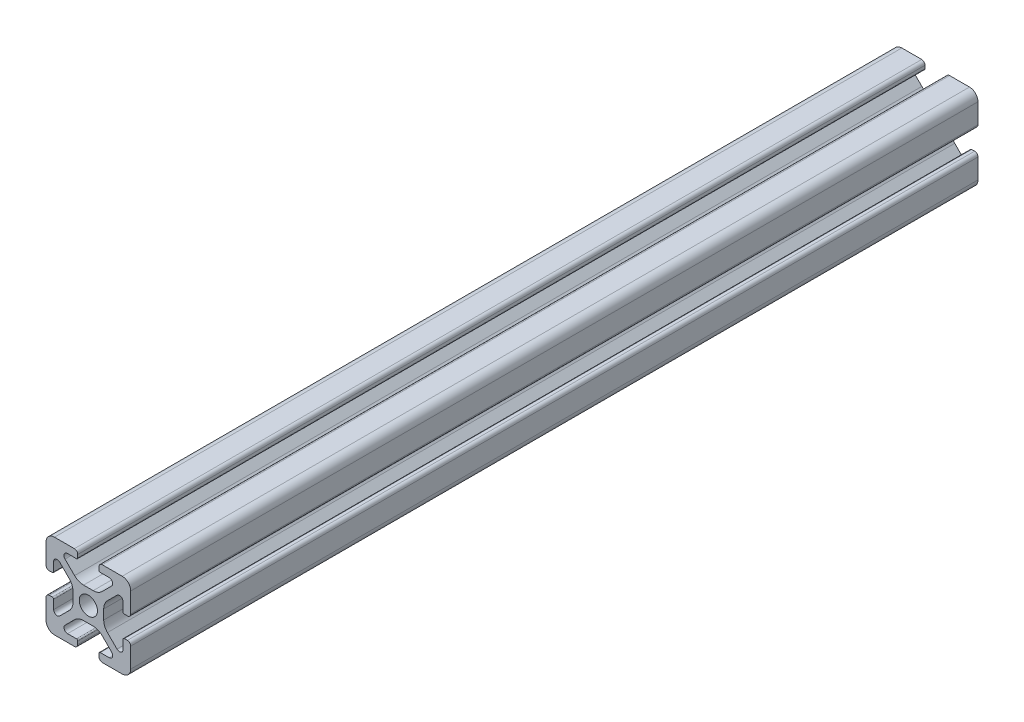
from build123d import *

# Parameters (mm, degrees)
SKETCH1_R           = 2.1463
BOSS_EXTRUDE1_DEPTH = 100


with BuildPart() as part:
    # Sketch1 → Boss-Extrude1 (new, symmetric)
    with BuildSketch(Plane.XY):
        with BuildLine():
            Line((-9.9949, 7.9883), (-9.9949, 3.2893))
            ThreePointArc((-9.9949, 3.2893), (-9.76427588, 2.73252412), (-9.2075, 2.5019))
            Line((-9.2075, 2.5019), (-8.4963, 2.5019))
            ThreePointArc((-8.4963, 2.5019), (-8.280773853, 2.591173853), (-8.1915, 2.8067))
            Line((-8.1915, 2.8067), (-8.1915, 4.9149))
            ThreePointArc((-8.1915, 4.9149), (-7.674065253, 5.689295824), (-6.760603096, 5.507596904))
            Line((-6.760603096, 5.507596904), (-4.505765747, 3.252759555))
            ThreePointArc((-4.505765747, 3.252759555), (-3.856054457, 2.280397894), (-3.627906192, 1.133419111))
            Line((-3.627906192, 1.133419111), (-3.627906192, -1.133419111))
            ThreePointArc((-3.627906192, -1.133419111), (-3.856054457, -2.280397894), (-4.505765747, -3.252759555))
            Line((-4.505765747, -3.252759555), (-6.760603096, -5.507596904))
            ThreePointArc((-6.760603096, -5.507596904), (-7.674065253, -5.689295824), (-8.1915, -4.9149))
            Line((-8.1915, -4.9149), (-8.1915, -2.8067))
            ThreePointArc((-8.1915, -2.8067), (-8.280773853, -2.591173853), (-8.4963, -2.5019))
            Line((-8.4963, -2.5019), (-9.2075, -2.5019))
            ThreePointArc((-9.2075, -2.5019), (-9.76427588, -2.73252412), (-9.9949, -3.2893))
            Line((-9.9949, -3.2893), (-9.9949, -7.9883))
            ThreePointArc((-9.9949, -7.9883), (-9.407180467, -9.407180467), (-7.9883, -9.9949))
            Line((-7.9883, -9.9949), (-3.2893, -9.9949))
            ThreePointArc((-3.2893, -9.9949), (-2.73252412, -9.76427588), (-2.5019, -9.2075))
            Line((-2.5019, -9.2075), (-2.5019, -8.4963))
            ThreePointArc((-2.5019, -8.4963), (-2.591173853, -8.280773853), (-2.8067, -8.1915))
            Line((-2.8067, -8.1915), (-4.9149, -8.1915))
            ThreePointArc((-4.9149, -8.1915), (-5.689295824, -7.674065253), (-5.507596904, -6.760603096))
            Line((-5.507596904, -6.760603096), (-3.252759555, -4.505765747))
            ThreePointArc((-3.252759555, -4.505765747), (-2.280397894, -3.856054457), (-1.133419111, -3.627906192))
            Line((-1.133419111, -3.627906192), (1.133419111, -3.627906192))
            ThreePointArc((1.133419111, -3.627906192), (2.280397894, -3.856054457), (3.252759555, -4.505765747))
            Line((3.252759555, -4.505765747), (5.507596904, -6.760603096))
            ThreePointArc((5.507596904, -6.760603096), (5.689295824, -7.674065253), (4.9149, -8.1915))
            Line((4.9149, -8.1915), (2.8067, -8.1915))
            ThreePointArc((2.8067, -8.1915), (2.591173853, -8.280773853), (2.5019, -8.4963))
            Line((2.5019, -8.4963), (2.5019, -9.2075))
            ThreePointArc((2.5019, -9.2075), (2.73252412, -9.76427588), (3.2893, -9.9949))
            Line((3.2893, -9.9949), (7.9883, -9.9949))
            ThreePointArc((7.9883, -9.9949), (9.407180467, -9.407180467), (9.9949, -7.9883))
            Line((9.9949, -7.9883), (9.9949, -3.2893))
            ThreePointArc((9.9949, -3.2893), (9.76427588, -2.73252412), (9.2075, -2.5019))
            Line((9.2075, -2.5019), (8.4963, -2.5019))
            ThreePointArc((8.4963, -2.5019), (8.280773853, -2.591173853), (8.1915, -2.8067))
            Line((8.1915, -2.8067), (8.1915, -4.9149))
            ThreePointArc((8.1915, -4.9149), (7.674065253, -5.689295824), (6.760603096, -5.507596904))
            Line((6.760603096, -5.507596904), (4.505765747, -3.252759555))
            ThreePointArc((4.505765747, -3.252759555), (3.856054457, -2.280397894), (3.627906192, -1.133419111))
            Line((3.627906192, -1.133419111), (3.627906192, 1.133419111))
            ThreePointArc((3.627906192, 1.133419111), (3.856054457, 2.280397894), (4.505765747, 3.252759555))
            Line((4.505765747, 3.252759555), (6.760603096, 5.507596904))
            ThreePointArc((6.760603096, 5.507596904), (7.674065253, 5.689295824), (8.1915, 4.9149))
            Line((8.1915, 4.9149), (8.1915, 2.8067))
            ThreePointArc((8.1915, 2.8067), (8.280773853, 2.591173853), (8.4963, 2.5019))
            Line((8.4963, 2.5019), (9.2075, 2.5019))
            ThreePointArc((9.2075, 2.5019), (9.76427588, 2.73252412), (9.9949, 3.2893))
            Line((9.9949, 3.2893), (9.9949, 7.9883))
            ThreePointArc((9.9949, 7.9883), (9.407180467, 9.407180467), (7.9883, 9.9949))
            Line((7.9883, 9.9949), (3.2893, 9.9949))
            ThreePointArc((3.2893, 9.9949), (2.73252412, 9.76427588), (2.5019, 9.2075))
            Line((2.5019, 9.2075), (2.5019, 8.4963))
            ThreePointArc((2.5019, 8.4963), (2.591173853, 8.280773853), (2.8067, 8.1915))
            Line((2.8067, 8.1915), (4.9149, 8.1915))
            ThreePointArc((4.9149, 8.1915), (5.689295824, 7.674065253), (5.507596904, 6.760603096))
            Line((5.507596904, 6.760603096), (3.252759555, 4.505765747))
            ThreePointArc((3.252759555, 4.505765747), (2.280397894, 3.856054457), (1.133419111, 3.627906192))
            Line((1.133419111, 3.627906192), (-1.133419111, 3.627906192))
            ThreePointArc((-1.133419111, 3.627906192), (-2.280397894, 3.856054457), (-3.252759555, 4.505765747))
            Line((-3.252759555, 4.505765747), (-5.507596904, 6.760603096))
            ThreePointArc((-5.507596904, 6.760603096), (-5.689295824, 7.674065253), (-4.9149, 8.1915))
            Line((-4.9149, 8.1915), (-2.8067, 8.1915))
            ThreePointArc((-2.8067, 8.1915), (-2.591173853, 8.280773853), (-2.5019, 8.4963))
            Line((-2.5019, 8.4963), (-2.5019, 9.2075))
            ThreePointArc((-2.5019, 9.2075), (-2.73252412, 9.76427588), (-3.2893, 9.9949))
            Line((-3.2893, 9.9949), (-7.9883, 9.9949))
            ThreePointArc((-7.9883, 9.9949), (-9.407180467, 9.407180467), (-9.9949, 7.9883))
        make_face()
        Circle(SKETCH1_R, mode=Mode.SUBTRACT)
    extrude(amount=BOSS_EXTRUDE1_DEPTH, both=True)


solid = part.part
